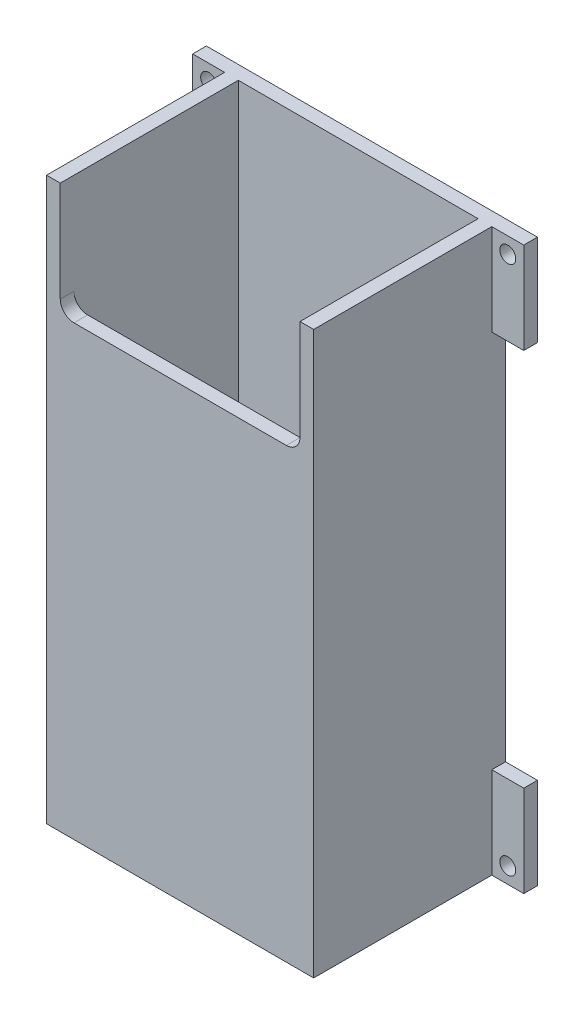
from build123d import *

# Parameters (mm, degrees)
SKETCH_1_W          = 58.5
SKETCH_1_H          = 42
EXTRUDE_1_DEPTH     = 123
CUT_EXTRUDE_1_DEPTH = 120
SKETCH_3_W          = 52.5
SKETCH_3_H          = 3
CUT_EXTRUDE_2_DEPTH = 25
FILLET_1_R          = 3
SKETCH_4_W          = 7
SKETCH_4_H          = 123
EXTRUDE_2_DEPTH     = 3
HOLE_WIZARD_1_D     = 3.5
SKETCH_7_2_W        = 7
SKETCH_7_2_H        = 83
CUT_EXTRUDE_3_DEPTH = 3
SKETCH_9_W          = 52.5
SKETCH_9_H          = 36
EXTRUDE_3_DEPTH     = 10


with BuildPart() as part:
    # 草图1 → 凸台-拉伸1 (new body)
    with BuildSketch(Plane(origin=(0, 0, 0), x_dir=(1, 0, 0), z_dir=(0, 1, 0))):
        with Locations((29.25, 21)):
            Rectangle(SKETCH_1_W, SKETCH_1_H)
    extrude(amount=EXTRUDE_1_DEPTH)

    # 草图2 → 切除-拉伸1 (cut)
    with BuildSketch(Plane(origin=(0, 123, 0), x_dir=(1, 0, 0), z_dir=(0, 1, 0))):
        Polygon((3, 3), (4.178571429, 3), (54.321428571, 39), (3, 39), align=None)
        Polygon((54.321428571, 39), (4.178571429, 3), (55.5, 3), (55.5, 39), align=None)
    extrude(amount=-CUT_EXTRUDE_1_DEPTH, mode=Mode.SUBTRACT)

    # 草图3 → 切除-拉伸2 (cut)
    with BuildSketch(Plane(origin=(0, 123, 0), x_dir=(1, 0, 0), z_dir=(0, 1, 0))):
        with Locations((29.25, 1.5)):
            Rectangle(SKETCH_3_W, SKETCH_3_H)
    extrude(amount=-CUT_EXTRUDE_2_DEPTH, mode=Mode.SUBTRACT)

    # 圆角1
    fillet_1_edges = [part.edges().sort_by_distance(p)[0] for p in [
        (3, 98, -1.5),
        (55.5, 98, -1.5),
    ]]
    fillet(fillet_1_edges, radius=FILLET_1_R)

    # 草图4 → 凸台-拉伸2 (add)
    with BuildSketch(Plane(origin=(0, 0, -42), x_dir=(-1, 0, 0), z_dir=(0, 0, -1))):
        with Locations((-62, 61.5)):
            Rectangle(SKETCH_4_W, SKETCH_4_H)
        with Locations((3.5, 61.5)):
            Rectangle(SKETCH_4_W, SKETCH_4_H)
    extrude(amount=-EXTRUDE_2_DEPTH)

    # 孔1 (through all)
    with Locations(Plane(origin=(0, 0, -42), x_dir=(-1, 0, 0), z_dir=(0, 0, -1))):
        with Locations((-62, 3.5), (3.5, 3.5), (3.5, 119.5), (-62, 119.5)):
            Hole(HOLE_WIZARD_1_D / 2)

    # Sketch 7 2 → 切除-拉伸3 (cut)
    with BuildSketch(Plane(origin=(0, 0, -42), x_dir=(-1, 0, 0), z_dir=(0, 0, -1))):
        with Locations((3.5, 61.5)):
            Rectangle(SKETCH_7_2_W, SKETCH_7_2_H)
        with Locations((-62, 61.5)):
            Rectangle(SKETCH_7_2_W, SKETCH_7_2_H)
    extrude(amount=-CUT_EXTRUDE_3_DEPTH, mode=Mode.SUBTRACT)

    # 草图9 → 凸台-拉伸3 (add)
    with BuildSketch(Plane(origin=(0, 3, 0), x_dir=(1, 0, 0), z_dir=(0, 1, 0))):
        with Locations((29.25, 21)):
            Rectangle(SKETCH_9_W, SKETCH_9_H)
    extrude(amount=EXTRUDE_3_DEPTH)


solid = part.part
